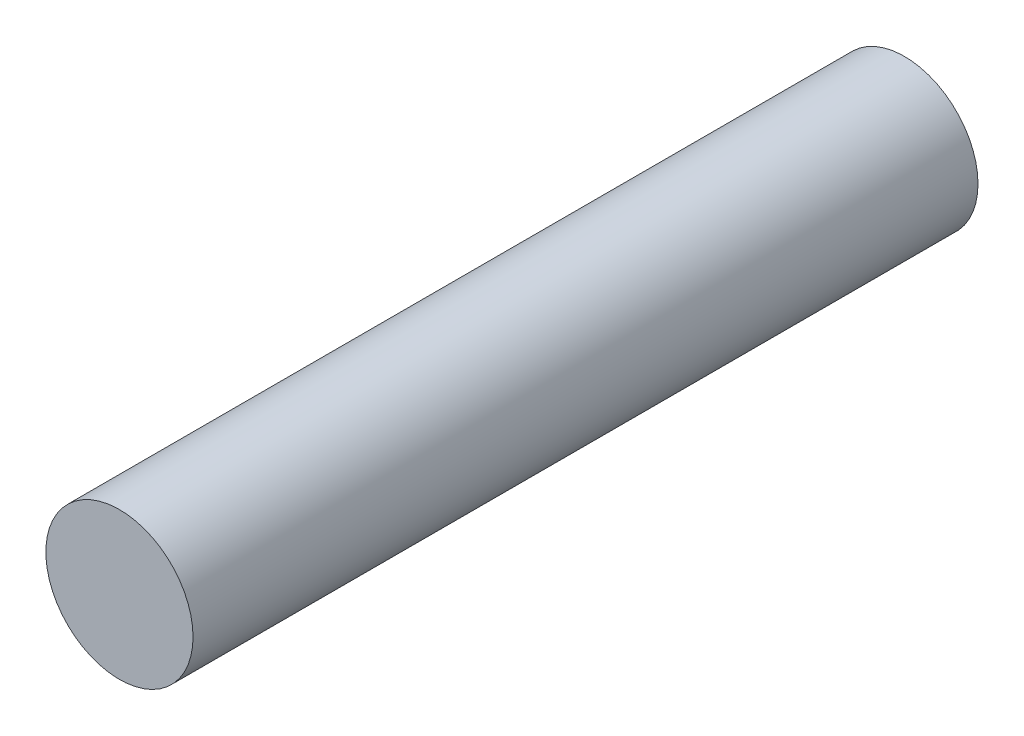
from build123d import *

# Parameters (mm, degrees)
SKETCH1_R           = 7.5
BOSS_EXTRUDE1_DEPTH = 80


with BuildPart() as part:
    # Sketch1 → Boss-Extrude1 (new body)
    with BuildSketch(Plane.XY):
        Circle(SKETCH1_R)
    extrude(amount=BOSS_EXTRUDE1_DEPTH)


solid = part.part
